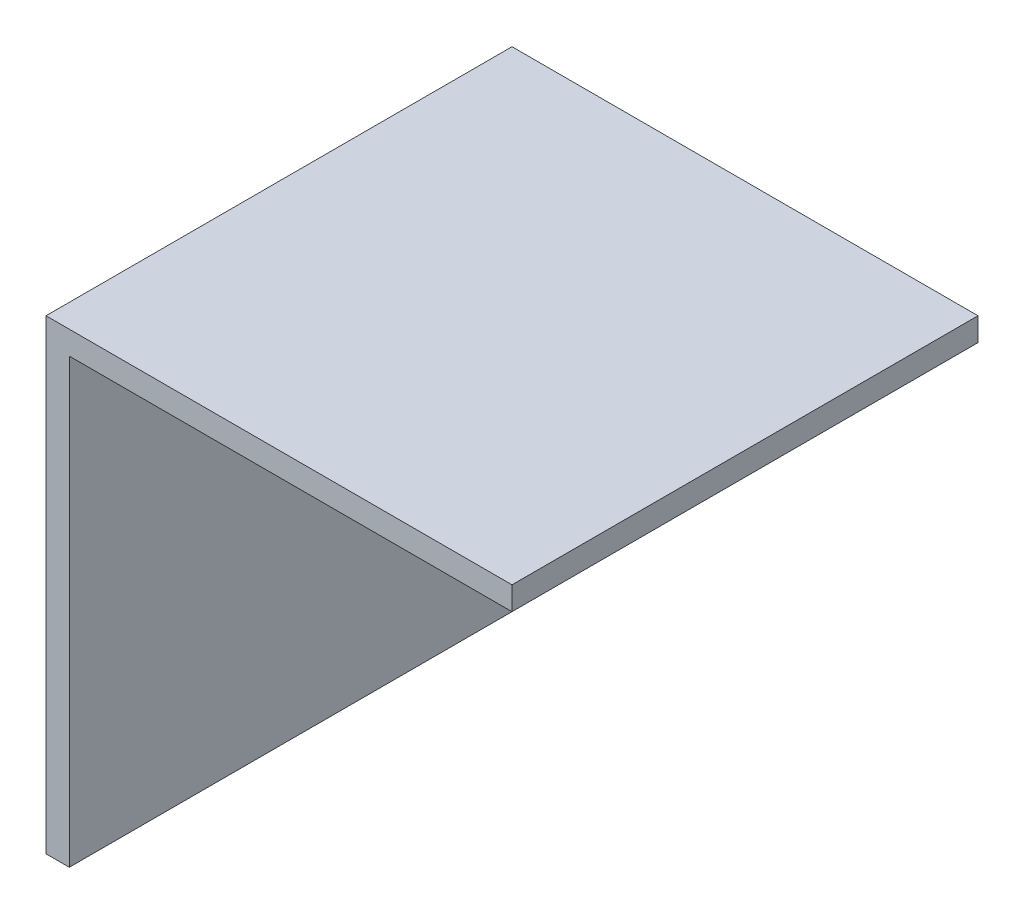
from build123d import *

# Parameters (mm, degrees)
BOSS_EXTRUDE1_DEPTH = 50.8


with BuildPart() as part:
    # Sketch1 → Boss-Extrude1 (new body)
    with BuildSketch(Plane.XY):
        Polygon((0, 0), (0, 50.8), (50.8, 50.8), (50.8, 48.26), (2.54, 48.26), (2.54, 0), align=None)
    extrude(amount=BOSS_EXTRUDE1_DEPTH)


solid = part.part
